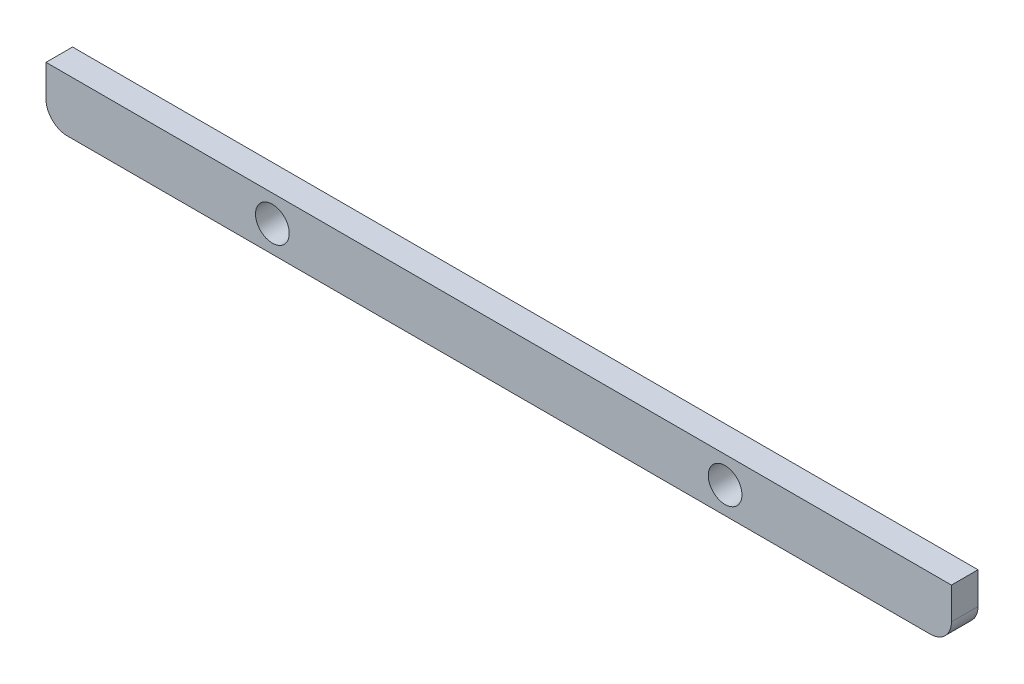
from build123d import *

# Parameters (mm, degrees)
SALIENTE_EXTRUIR1_DEPTH = 2.5
CROQUIS2_R              = 3.175
CORTAR_EXTRUIR1_DEPTH   = 86.532786696


with BuildPart() as part:
    # Croquis1 → Saliente-Extruir1 (new, symmetric)
    with BuildSketch(Plane.XY):
        with BuildLine():
            Line((-85.24, 5), (85.24, 5))
            Line((85.24, 5), (85.24, -1))
            ThreePointArc((85.24, -1), (84.068427125, -3.828427125), (81.24, -5))
            Line((81.24, -5), (-81.24, -5))
            ThreePointArc((-81.24, -5), (-84.068427125, -3.828427125), (-85.24, -1))
            Line((-85.24, -1), (-85.24, 5))
        make_face()
    extrude(amount=SALIENTE_EXTRUIR1_DEPTH, both=True)

    # Croquis2 → Cortar-Extruir1 (cut, through all)
    with BuildSketch(Plane.XY.offset(2.5)):
        with Locations((42.62, 0)):
            Circle(CROQUIS2_R)
        with Locations((-42.62, 0)):
            Circle(CROQUIS2_R)
    extrude(amount=-CORTAR_EXTRUIR1_DEPTH, mode=Mode.SUBTRACT)


solid = part.part
